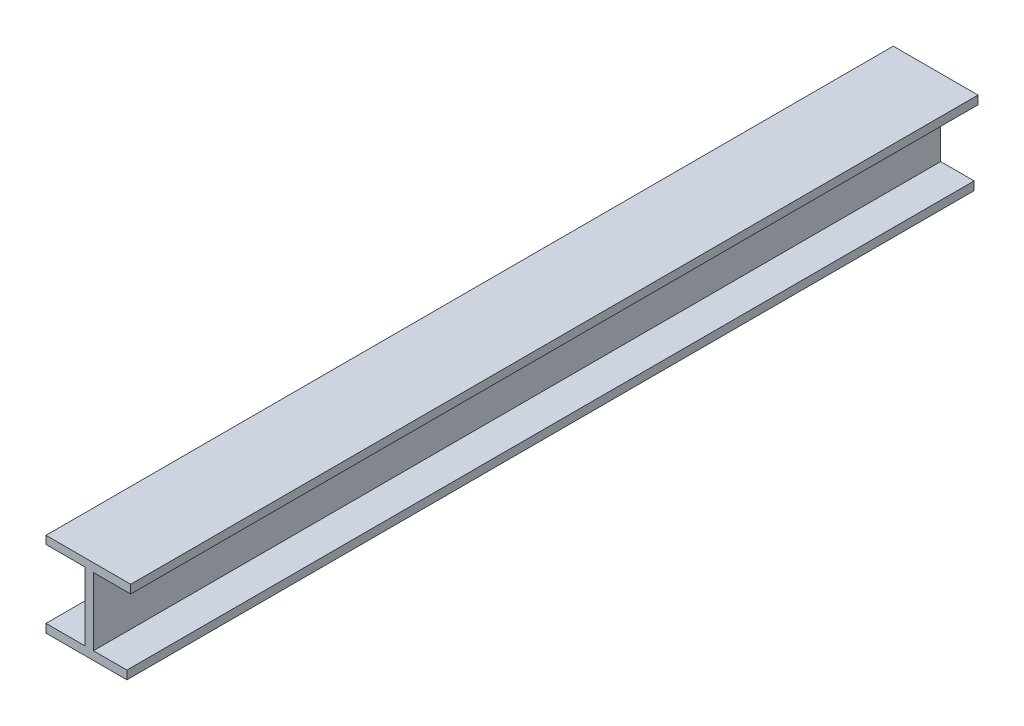
from build123d import *

# Parameters (mm, degrees)
BOSS_EXTRUDE1_DEPTH = 1000


with BuildPart() as part:
    # Sketch1 → Boss-Extrude1 (new body)
    with BuildSketch(Plane.XY):
        Polygon((-45.954692557, 67.475728155), (-45.954692557, 58.090614887), (0, 58.090614887), (0, -22.524271845), (-45.954692557, -22.524271845), (-45.954692557, -32.524271845), (49.514563107, -32.524271845), (49.514563107, -22.524271845), (10, -22.524271845), (10, 57.475728155), (54.045307443, 57.475728155), (54.045307443, 67.475728155), align=None)
    extrude(amount=BOSS_EXTRUDE1_DEPTH)


solid = part.part
